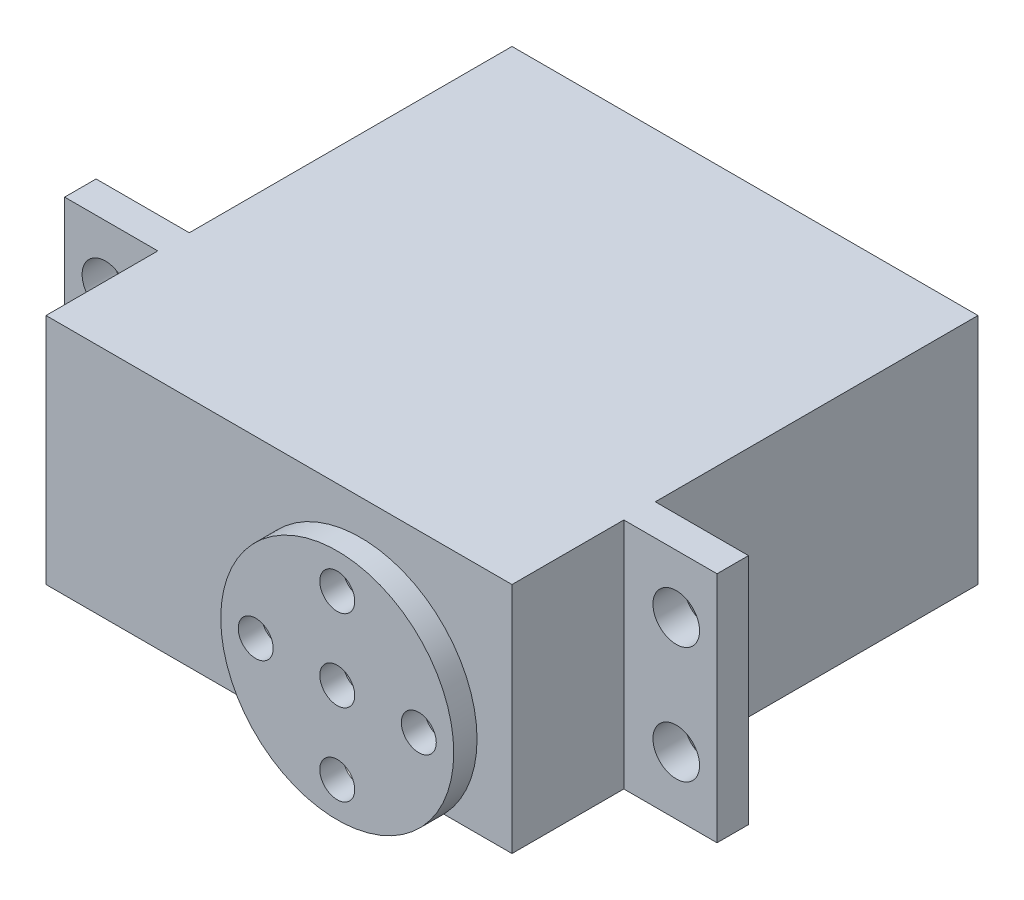
from build123d import *

# Parameters (mm, degrees)
SKETCH_1_W           = 40
SKETCH_1_H           = 20
EXTRUDE_1_DEPTH      = 27.7
SKETCH_2_W           = 56
SKETCH_2_H           = 20
SKETCH_2_R           = 2
EXTRUDE_2_DEPTH      = 2.7
SKETCH_5_W           = 40
SKETCH_5_H           = 20
EXTRUDE_3_DEPTH      = 40
SKETCH_6_R           = 3
EXTRUDE_4_DEPTH      = 4.5
EXTRUDE_5_DEPTH      = 0.5
EXTRUDE_5_DEPTH_BACK = 1.5
SKETCH_7_R           = 10
SKETCH_8_R           = 1.5
CUT_EXTRUDE_4_DEPTH  = 2


with BuildPart() as part:
    # 草图1 → 凸台-拉伸1 (new body)
    with BuildSketch(Plane.XY):
        with Locations((-20, 10)):
            Rectangle(SKETCH_1_W, SKETCH_1_H)
    extrude(amount=EXTRUDE_1_DEPTH)

    # 草图2 → 凸台-拉伸2 (add)
    with BuildSketch(Plane.XY.offset(27.7)):
        with Locations((-20, 10)):
            Rectangle(SKETCH_2_W, SKETCH_2_H)
        with Locations(Location((-44.5, 15, 0), (0, 0, 180))):
            Circle(SKETCH_2_R, mode=Mode.SUBTRACT)
        with Locations(Location((-44.5, 5, 0), (0, 0, 180))):
            Circle(SKETCH_2_R, mode=Mode.SUBTRACT)
        with Locations(Location((4.5, 15, 0), (0, 0, 180))):
            Circle(SKETCH_2_R, mode=Mode.SUBTRACT)
        with Locations(Location((4.5, 5, 0), (0, 0, 180))):
            Circle(SKETCH_2_R, mode=Mode.SUBTRACT)
    extrude(amount=EXTRUDE_2_DEPTH)

    # 草图5 → 凸台-拉伸3 (add)
    with BuildSketch(Plane(origin=(0, 0, 0), x_dir=(-1, 0, 0), z_dir=(0, 0, -1))):
        with Locations((20, 10)):
            Rectangle(SKETCH_5_W, SKETCH_5_H)
    extrude(amount=-EXTRUDE_3_DEPTH)

    # 草图6 → 凸台-拉伸4 (add)
    with BuildSketch(Plane.XY.offset(40)):
        with Locations(Location((-10, 10, 0), (0, 0, 180))):
            Circle(SKETCH_6_R)
    extrude(amount=EXTRUDE_4_DEPTH)

    # 草图7 → 凸台-拉伸5 (add, two sides: drawn at the far end of the back side and taken through both)
    with BuildSketch(Plane.XY.offset(44.5).offset(-EXTRUDE_5_DEPTH_BACK)):
        with Locations((-10, 10)):
            Circle(SKETCH_7_R)
    extrude(amount=EXTRUDE_5_DEPTH + EXTRUDE_5_DEPTH_BACK)

    # 草图8 → 切除-拉伸4 (cut)
    with BuildSketch(Plane.XY.offset(45)):
        with Locations((-10, 10)):
            Circle(SKETCH_8_R)
        with Locations((-3, 10)):
            Circle(SKETCH_8_R)
        with Locations((-10, 17)):
            Circle(SKETCH_8_R)
        with Locations((-10, 3)):
            Circle(SKETCH_8_R)
        with Locations((-17, 10)):
            Circle(SKETCH_8_R)
    extrude(amount=-CUT_EXTRUDE_4_DEPTH, mode=Mode.SUBTRACT)


solid = part.part
